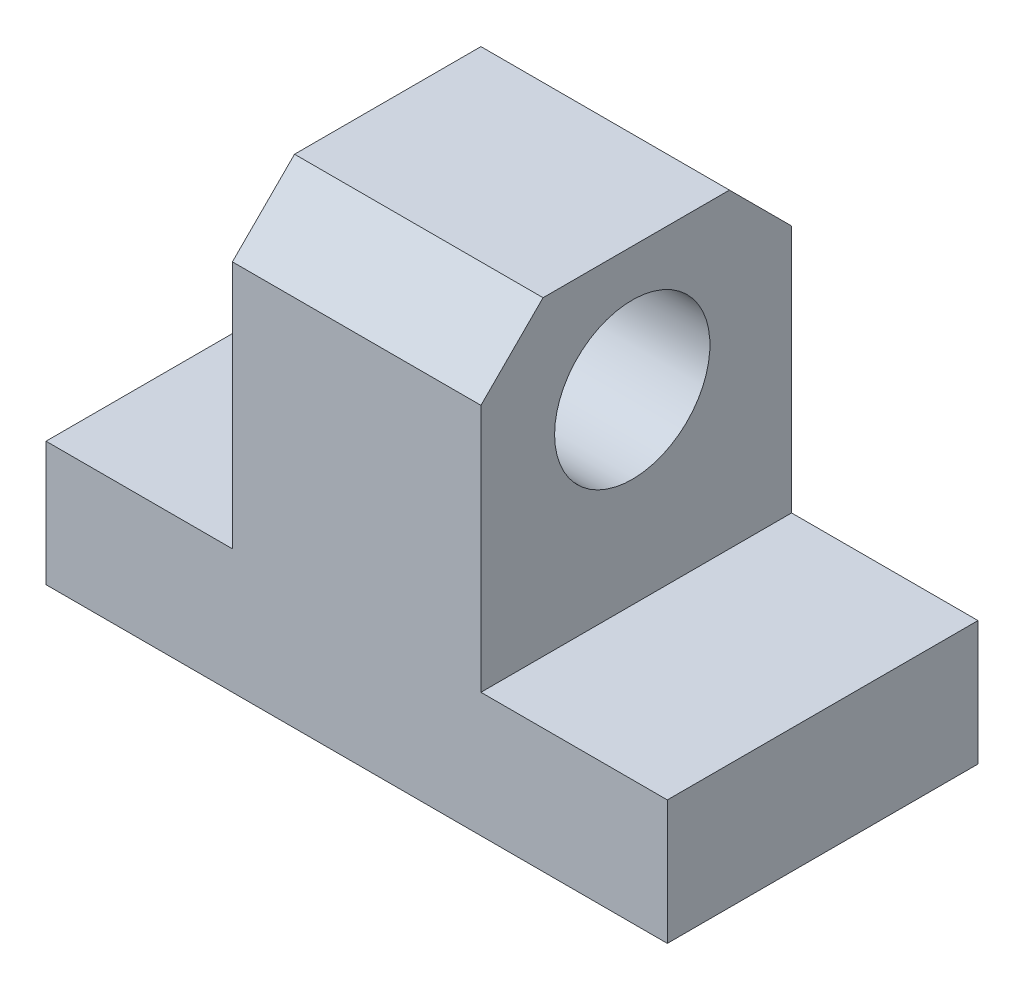
from build123d import *

# Parameters (mm, degrees)
SKETCH_1_W          = 20
SKETCH_1_H          = 10
EXTRUDE_1_DEPTH     = 4
SKETCH_2_W          = 8
SKETCH_2_H          = 10
EXTRUDE_2_DEPTH     = 10
SKETCH_3_R          = 2.499995339
CUT_EXTRUDE_1_DEPTH = 21.420577857
CHAMFER_1_SIZE      = 2


with BuildPart() as part:
    # Эскиз1 → Вытянуть1 (new body)
    with BuildSketch(Plane(origin=(0, 0, 0), x_dir=(1, 0, 0), z_dir=(0, 1, 0))):
        Rectangle(SKETCH_1_W, SKETCH_1_H)
    extrude(amount=EXTRUDE_1_DEPTH)

    # Эскиз2 → Вытянуть2 (add)
    with BuildSketch(Plane(origin=(0, 4, 0), x_dir=(1, 0, 0), z_dir=(0, 1, 0))):
        Rectangle(SKETCH_2_W, SKETCH_2_H)
    extrude(amount=EXTRUDE_2_DEPTH)

    # Эскиз3 → Вырез-Вытянуть1 (cut, through all)
    with BuildSketch(Plane.ZY.offset(4)):
        with Locations((0.128840194, 10)):
            Circle(SKETCH_3_R)
    extrude(amount=-CUT_EXTRUDE_1_DEPTH, mode=Mode.SUBTRACT)

    # Фаска1
    chamfer_1_edges = [part.edges().sort_by_distance(p)[0] for p in [
        (0, 14, -5),
        (0, 14, 5),
    ]]
    chamfer(chamfer_1_edges, length=CHAMFER_1_SIZE)


solid = part.part
